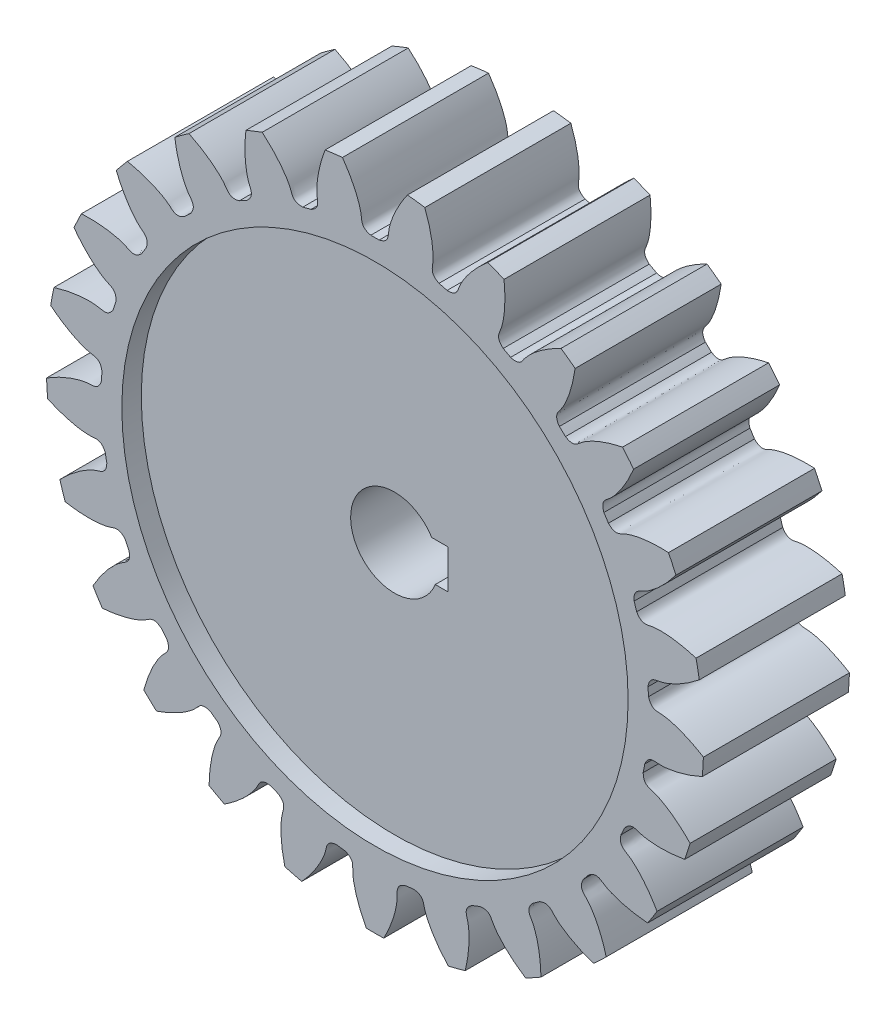
from build123d import *

# Parameters (mm, degrees)
SKETCH_1_R               = 33.75
EXTRUDE_1_DEPTH          = 15
CUT_EXTRUDE_1_DEPTH      = 51.03124024
PATTERN_CIRCULAR_1_COUNT = 25
CUT_EXTRUDE_2_DEPTH      = 51.016316407
SKETCH_5_R               = 26
CUT_EXTRUDE_3_DEPTH      = 2
CUT_EXTRUDE_START        = -2
SKETCH_6_R               = 26
CUT_EXTRUDE_4_DEPTH      = 2


with BuildPart() as part:
    # 草图1 → 凸台-拉伸1 (new body)
    with BuildSketch(Plane.XY):
        Circle(SKETCH_1_R)
    extrude(amount=EXTRUDE_1_DEPTH)

    # 草图2 → 切除-拉伸1 (cut, through all)
    with BuildSketch(Plane.XY):
        with BuildLine():
            ThreePointArc((0.430146219, 28.121710461), (0, 28.125), (-0.430146219, 28.121710461))
            add(Edge.make_bspline(
                [(-0.430146219, 28.121710461), (-1.433349532, 28.337702905), (-1.338769089, 28.943153487), (-1.435488464, 29.545131888), (-1.449053178, 29.620271105), (-1.466441077, 29.70663881), (-1.488088797, 29.804111124), (-1.514451962, 29.912546453), (-1.545974823, 30.031790993), (-1.583099615, 30.161677082), (-1.626263112, 30.302023874), (-1.675897231, 30.452637289), (-1.732428388, 30.613310197), (-1.796277232, 30.783822544), (-1.867858277, 30.963941511), (-1.947579565, 31.153421666), (-2.035842328, 31.352005135), (-2.133040655, 31.559421778), (-2.239561158, 31.775389372), (-2.355782653, 31.999613804), (-2.482075837, 32.231789274), (-2.618802973, 32.471598499), (-2.766317578, 32.718712933), (-2.924964124, 32.972792994), (-3.095077732, 33.23348829), (-3.276983884, 33.500437861), (-3.470998132, 33.77327043), (-3.677425818, 34.051604651), (-3.896561798, 34.335049376), (-4.128690173, 34.623203918), (-4.374084028, 34.915658331), (-4.633005175, 35.211993689), (-4.905703905, 35.511782378), (-5.192418745, 35.814588382), (-5.493376225, 36.119967596), (-5.808790653, 36.427468123), (-6.138863886, 36.73663059), (-6.483785148, 37.046988468), (-6.843730716, 37.358068397), (-7.349934862, 37.778165685), (-7.743666374, 38.085232882), (-8.013178689, 38.287085428)],
                knots=[0, 0, 0, 0, 0.130741207, 0.13574479, 0.141658115, 0.148481183, 0.156213993, 0.164856545, 0.174408839, 0.184870876, 0.196242655, 0.208524177, 0.221715441, 0.235816447, 0.250827195, 0.266747686, 0.283577919, 0.301317894, 0.319967612, 0.339527072, 0.359996274, 0.381375219, 0.403663906, 0.426862335, 0.450970507, 0.475988421, 0.501916077, 0.528753476, 0.556500617, 0.5851575, 0.614724126, 0.645200493, 0.676586604, 0.708882456, 0.742088051, 0.776203388, 0.811228468, 0.847163289, 0.884007854, 0.92176216, 1, 1, 1, 1], degree=3))
            ThreePointArc((-8.013178689, 38.287085428), (0, 39.116645348), (8.013178689, 38.287085428))
            add(Edge.make_bspline(
                [(0.430146219, 28.121710461), (1.433349532, 28.337702905), (1.338769089, 28.943153487), (1.435488464, 29.545131888), (1.449053178, 29.620271105), (1.466441077, 29.70663881), (1.488088797, 29.804111124), (1.514451962, 29.912546453), (1.545974823, 30.031790993), (1.583099615, 30.161677082), (1.626263112, 30.302023874), (1.675897231, 30.452637289), (1.732428388, 30.613310197), (1.796277232, 30.783822544), (1.867858277, 30.963941511), (1.947579565, 31.153421666), (2.035842328, 31.352005135), (2.133040655, 31.559421778), (2.239561158, 31.775389372), (2.355782653, 31.999613804), (2.482075837, 32.231789274), (2.618802973, 32.471598499), (2.766317578, 32.718712933), (2.924964124, 32.972792994), (3.095077732, 33.23348829), (3.276983884, 33.500437861), (3.470998132, 33.77327043), (3.677425818, 34.051604651), (3.896561798, 34.335049376), (4.128690173, 34.623203918), (4.374084028, 34.915658331), (4.633005175, 35.211993689), (4.905703905, 35.511782378), (5.192418745, 35.814588382), (5.493376225, 36.119967596), (5.808790653, 36.427468123), (6.138863886, 36.73663059), (6.483785148, 37.046988468), (6.843730716, 37.358068397), (7.349934862, 37.778165685), (7.743666374, 38.085232882), (8.013178689, 38.287085428)],
                knots=[0, 0, 0, 0, 0.130741207, 0.13574479, 0.141658115, 0.148481183, 0.156213993, 0.164856545, 0.174408839, 0.184870876, 0.196242655, 0.208524177, 0.221715441, 0.235816447, 0.250827195, 0.266747686, 0.283577919, 0.301317894, 0.319967612, 0.339527072, 0.359996274, 0.381375219, 0.403663906, 0.426862335, 0.450970507, 0.475988421, 0.501916077, 0.528753476, 0.556500617, 0.5851575, 0.614724126, 0.645200493, 0.676586604, 0.708882456, 0.742088051, 0.776203388, 0.811228468, 0.847163289, 0.884007854, 0.92176216, 1, 1, 1, 1], degree=3))
        make_face()
    cut_extrude_1 = extrude(amount=CUT_EXTRUDE_1_DEPTH, mode=Mode.SUBTRACT)

    # 阵列(圆周)1: 切除-拉伸1 ×25 about axis
    pattern_circular_1_axis = Axis((0, 0, 15), (0, 0, -1))
    for i in range(1, PATTERN_CIRCULAR_1_COUNT):
        add(cut_extrude_1.rotate(pattern_circular_1_axis, i * 360 / PATTERN_CIRCULAR_1_COUNT), mode=Mode.SUBTRACT)

    # 草图4 → 切除-拉伸2 (cut, through all)
    with BuildSketch(Plane.XY.offset(15)):
        with BuildLine():
            Line((3.829258824, 2.363636364), (5.5, 2.363636364))
            Line((5.5, 2.363636364), (5.5, -1.636363636))
            Line((5.5, -1.636363636), (4.191934404, -1.636363636))
            ThreePointArc((4.191934404, -1.636363636), (-4.48161636, -0.406343204), (3.829258824, 2.363636364))
        make_face()
    extrude(amount=-CUT_EXTRUDE_2_DEPTH, mode=Mode.SUBTRACT)

    # 草图5 → 切除-拉伸3 (cut)
    with BuildSketch(Plane.XY.offset(15)):
        Circle(SKETCH_5_R)
    extrude(amount=-CUT_EXTRUDE_3_DEPTH, mode=Mode.SUBTRACT)

    # 草图6 → 切除-拉伸4 (cut)
    with BuildSketch(Plane(origin=(0, 0, 0), x_dir=(-1, 0, 0), z_dir=(0, 0, -1)).offset(CUT_EXTRUDE_START)):
        Circle(SKETCH_6_R)
    extrude(amount=CUT_EXTRUDE_4_DEPTH, mode=Mode.SUBTRACT)


solid = part.part
